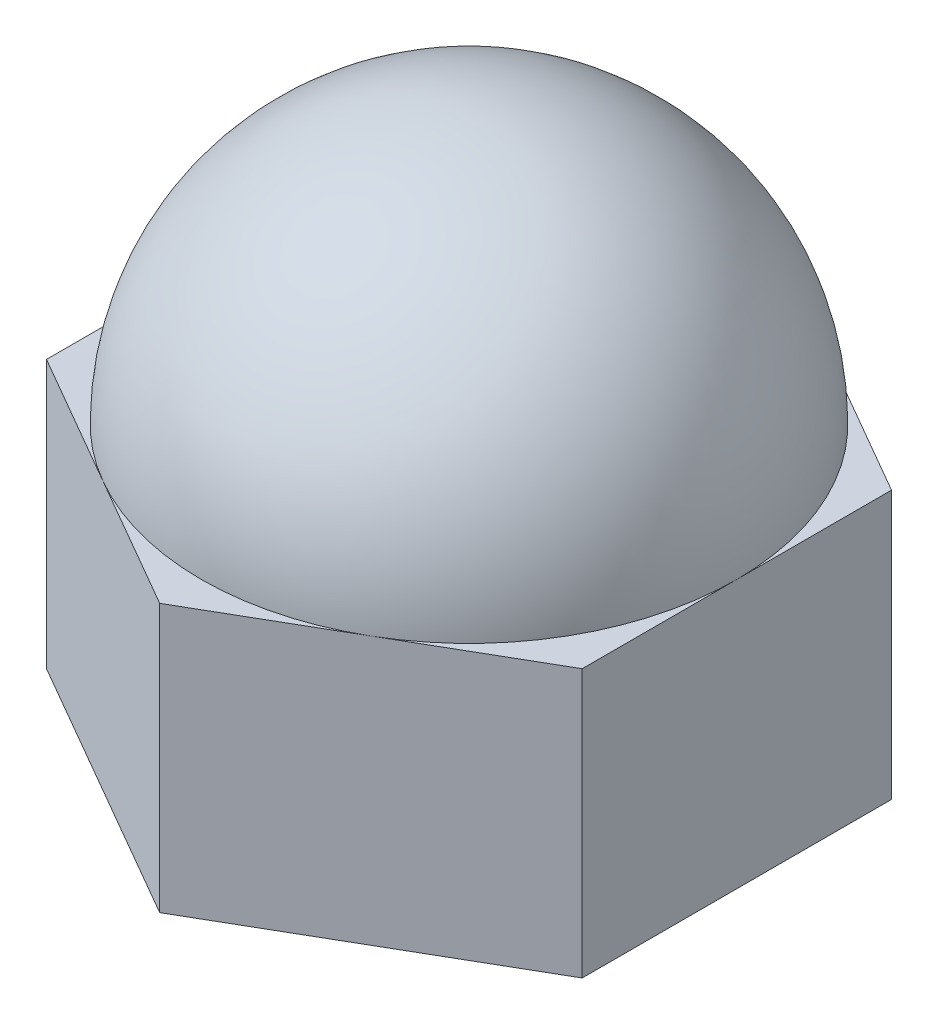
from build123d import *

# Parameters (mm, degrees)
EXTRUDE_1_DEPTH     = 6.5
SKETCH_6_R          = 4
CUT_EXTRUDE_1_DEPTH = 6.5


with BuildPart() as part:
    # ｽｹｯﾁ1 → ﾎﾞｽ - 押し出し1 (new body)
    with BuildSketch(Plane(origin=(0, 0, 0), x_dir=(1, 0, 0), z_dir=(0, 1, 0))):
        Polygon((0, -7.505553499), (6.5, -3.75277675), (6.5, 3.75277675), (0, 7.505553499), (-6.5, 3.75277675), (-6.5, -3.75277675), align=None)
    extrude(amount=EXTRUDE_1_DEPTH)

    # ｽｹｯﾁ5 → 回転1 (revolve)
    with BuildSketch(Plane.XY):
        with BuildLine():
            Line((0, 13), (0, 6.5))
            Line((0, 6.5), (6.5, 6.5))
            ThreePointArc((6.5, 6.5), (4.596194078, 11.096194078), (0, 13))
        make_face()
    revolve(axis=Axis((0, 13, 0), (0, -1, 0)))

    # ｽｹｯﾁ6 → ｶｯﾄ - 押し出し1 (cut)
    with BuildSketch(Plane.XZ):
        with Locations(Location((0, 0, 0), (0, 0, 270))):
            Circle(SKETCH_6_R)
    extrude(amount=-CUT_EXTRUDE_1_DEPTH, mode=Mode.SUBTRACT)


solid = part.part
